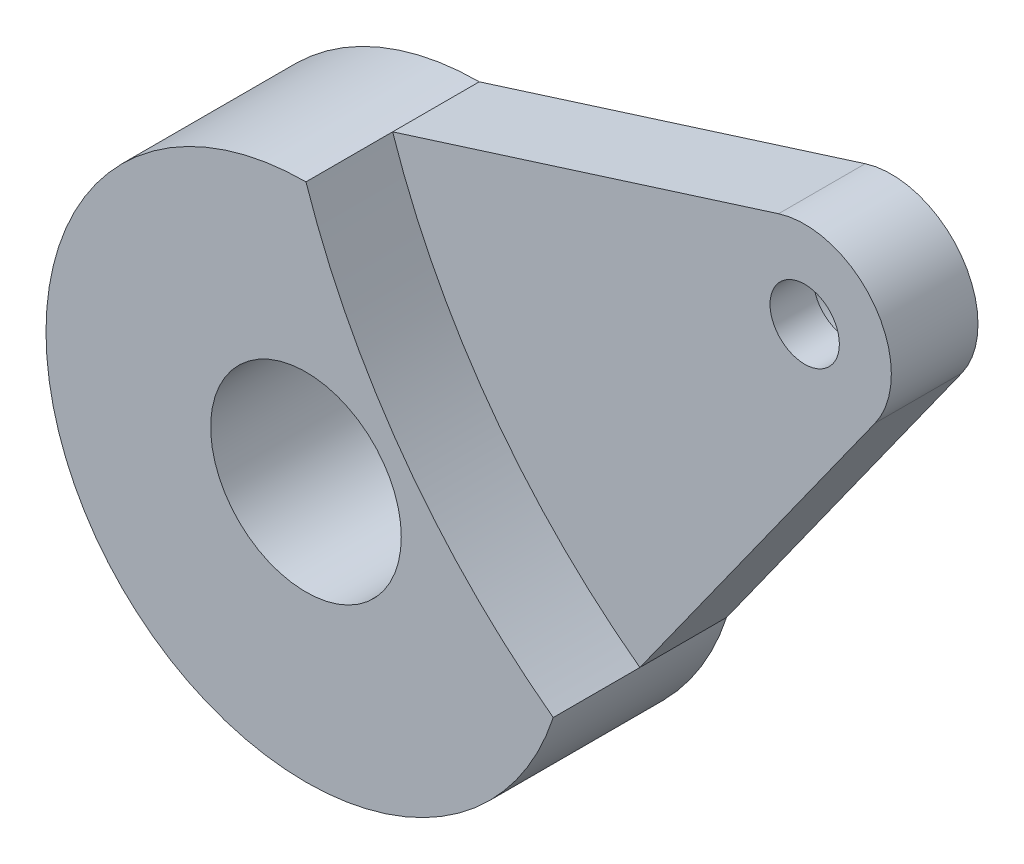
from build123d import *

# Parameters (mm, degrees)
SKETCH2_R           = 4
SKETCH2_R_2         = 11
BOSS_EXTRUDE1_DEPTH = 20
SKETCH3_R           = 7.5
CUT_EXTRUDE1_DEPTH  = 5
SKETCH4_R           = 20
SKETCH4_R_2         = 16
BOSS_EXTRUDE2_DEPTH = 10
CUT_EXTRUDE2_START  = -10
CUT_EXTRUDE2_DEPTH  = 10


with BuildPart() as part:
    # Sketch2 → Boss-Extrude1 (new body)
    with BuildSketch(Plane.XY):
        with BuildLine():
            Line((44.537767857, 44.08379372), (0, 30))
            ThreePointArc((0, 30), (-24.270509831, -17.633557569), (28.531695489, -9.270509831))
            Line((28.531695489, -9.270509831), (55.68910644, 28.735292906))
            ThreePointArc((55.68910644, 28.735292906), (55.642995759, 40.427002804), (44.537767857, 44.08379372))
        make_face()
        with Locations((47.552825815, 34.549150281)):
            Circle(SKETCH2_R, mode=Mode.SUBTRACT)
        Circle(SKETCH2_R_2, mode=Mode.SUBTRACT)
    extrude(amount=BOSS_EXTRUDE1_DEPTH)

    # Sketch3 → Cut-Extrude1 (cut)
    with BuildSketch(Plane(origin=(0, 0, 0), x_dir=(-1, 0, 0), z_dir=(0, 0, -1))):
        with Locations((-47.552825815, 34.549150281)):
            Circle(SKETCH3_R)
    extrude(amount=-CUT_EXTRUDE1_DEPTH, mode=Mode.SUBTRACT)

    # Sketch4 → Boss-Extrude2 (add)
    with BuildSketch(Plane(origin=(0, 0, 0), x_dir=(-1, 0, 0), z_dir=(0, 0, -1))):
        with Locations(Location((0, 0, 0), (0, 0, 180))):
            Circle(SKETCH4_R)
        Circle(SKETCH4_R_2, mode=Mode.SUBTRACT)
    extrude(amount=BOSS_EXTRUDE2_DEPTH)

    # Sketch5 → Cut-Extrude2 (cut)
    with BuildSketch(Plane.XY.offset(20).offset(CUT_EXTRUDE2_START)):
        with BuildLine():
            Line((44.537767857, 44.08379372), (0, 30))
            ThreePointArc((0, 30), (11.251062951, 8.174375719), (28.531695489, -9.270509831))
            Line((28.531695489, -9.270509831), (55.68910644, 28.735292906))
            ThreePointArc((55.68910644, 28.735292906), (55.642995759, 40.427002804), (44.537767857, 44.08379372))
        make_face()
    extrude(amount=CUT_EXTRUDE2_DEPTH, mode=Mode.SUBTRACT)


solid = part.part
